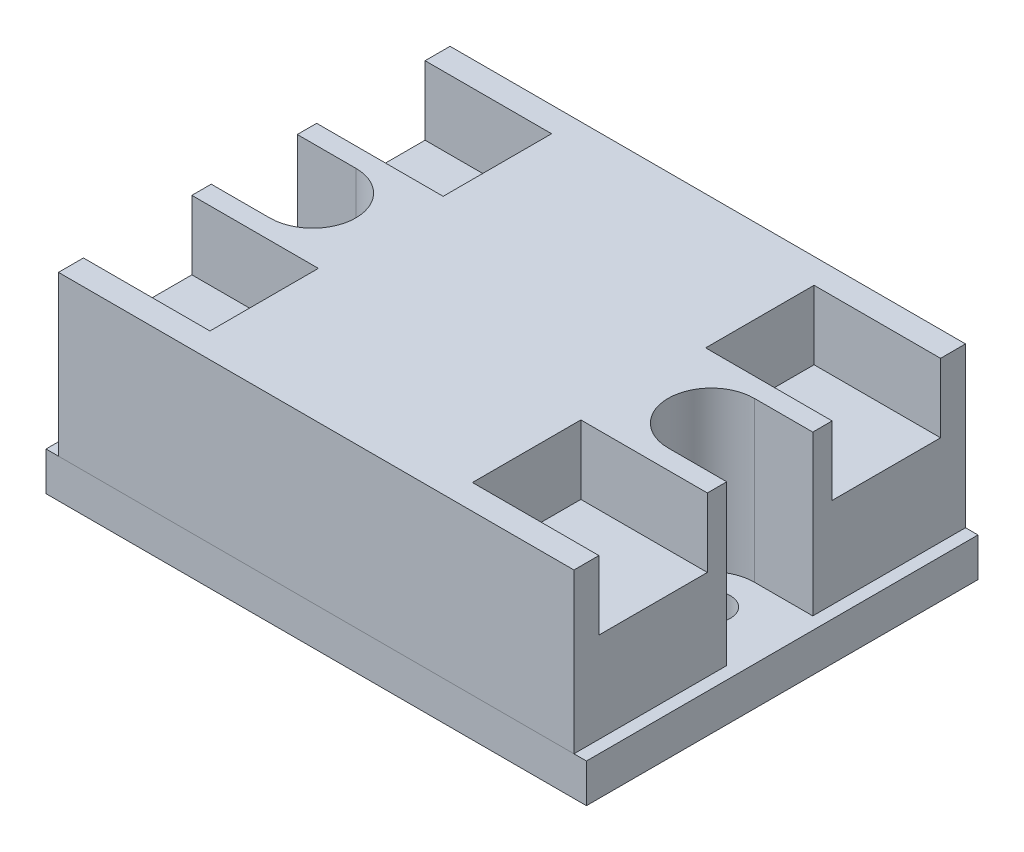
from build123d import *

# Parameters (mm, degrees)
ESQUISSE1_W               = 62.8
ESQUISSE1_H               = 45.5
BOSS_EXTRU_1_DEPTH        = 4.5
ESQUISSE2_W               = 59.9
ESQUISSE2_H               = 45.5
BOSS_EXTRU_2_DEPTH        = 18.5
ENL_V_MAT_EXTRU_1_DEPTH   = 18.5
ESQUISSE4_W               = 14.7
ESQUISSE4_H               = 12.6
ENL_V_MAT_EXTRU_2_DEPTH   = 8
ESQUISSE6_W               = 2.25
ESQUISSE6_H               = 4.5
D_GAGEMENT_M41_AT_2_COUNT = 2
D_GAGEMENT_M41_AT_2_PITCH = 46.3


with BuildPart() as part:
    # Esquisse1 → Boss.-Extru.1 (new body)
    with BuildSketch(Plane(origin=(0, 0, 0), x_dir=(1, 0, 0), z_dir=(0, 1, 0))):
        Rectangle(ESQUISSE1_W, ESQUISSE1_H)
    extrude(amount=BOSS_EXTRU_1_DEPTH)

    # Esquisse6 → Dégagement M41 (revolve, cut)
    with BuildSketch(Plane(origin=(23.15, 4.5, 0), x_dir=(0, 0, 1), z_dir=(1, 0, 0))):
        with Locations((1.125, 2.25)):
            Rectangle(ESQUISSE6_W, ESQUISSE6_H)
    d_gagement_m41 = revolve(axis=Axis((23.15, 10.85, 0), (0, -1, 0)), mode=Mode.SUBTRACT)

    # Dégagement M41 at 2: Dégagement M41 ×2
    with Locations(*[(-i * D_GAGEMENT_M41_AT_2_PITCH, 0, 0) for i in range(1, D_GAGEMENT_M41_AT_2_COUNT)]):
        add(d_gagement_m41, mode=Mode.SUBTRACT)


with BuildPart() as body_2:
    # Esquisse2 → Boss.-Extru.2 (new body)
    with BuildSketch(Plane(origin=(0, 4.5, 0), x_dir=(1, 0, 0), z_dir=(0, 1, 0))):
        Rectangle(ESQUISSE2_W, ESQUISSE2_H)
    extrude(amount=BOSS_EXTRU_2_DEPTH)

    # Esquisse3 → Enlèv. mat.-Extru.1 (cut)
    with BuildSketch(Plane(origin=(0, 23, 0), x_dir=(1, 0, 0), z_dir=(0, 1, 0))):
        with BuildLine():
            Line((36.75, -5), (23.15, -5))
            ThreePointArc((23.15, -5), (18.15, 0), (23.15, 5))
            Line((23.15, 5), (36.75, 5))
            ThreePointArc((36.75, 5), (41.75, 0), (36.75, -5))
        make_face()
        with BuildLine():
            Line((-36.75, -5), (-23.15, -5))
            ThreePointArc((-23.15, -5), (-18.15, 0), (-23.15, 5))
            Line((-23.15, 5), (-36.75, 5))
            ThreePointArc((-36.75, 5), (-41.75, 0), (-36.75, -5))
        make_face()
    extrude(amount=-ENL_V_MAT_EXTRU_1_DEPTH, mode=Mode.SUBTRACT)

    # Esquisse4 → Enlèv. mat.-Extru.2 (cut)
    with BuildSketch(Plane(origin=(0, 23, 0), x_dir=(1, 0, 0), z_dir=(0, 1, 0))):
        with Locations((22.6, 13.55)):
            Rectangle(ESQUISSE4_W, ESQUISSE4_H)
        with Locations((-22.6, 13.55)):
            Rectangle(ESQUISSE4_W, ESQUISSE4_H)
        with Locations((22.6, -13.55)):
            Rectangle(ESQUISSE4_W, ESQUISSE4_H)
        with Locations((-22.6, -13.55)):
            Rectangle(ESQUISSE4_W, ESQUISSE4_H)
    extrude(amount=-ENL_V_MAT_EXTRU_2_DEPTH, mode=Mode.SUBTRACT)


solid = Compound([part.part, body_2.part])
